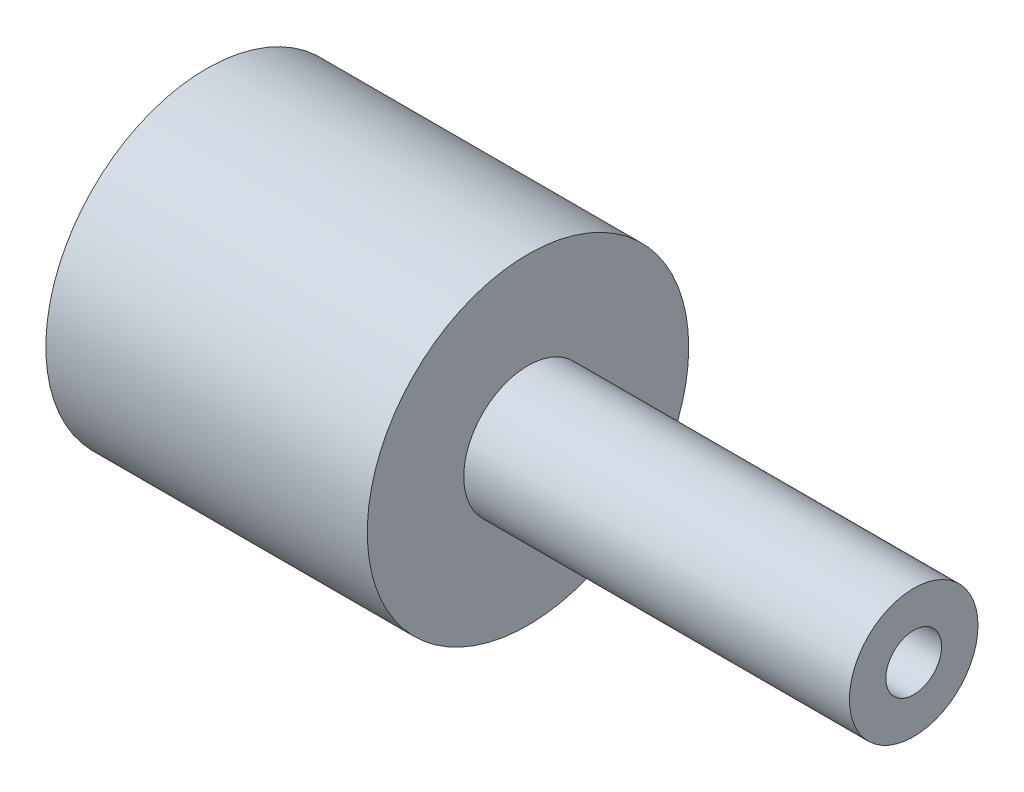
from build123d import *

# Parameters (mm, degrees)
SKETCH_1_R          = 3
EXTRUDE_1_DEPTH     = 33
SKETCH_2_R          = 1.3
CUT_EXTRUDE_1_DEPTH = 5
CUT_EXTRUDE_START   = -5
SKETCH_3_R          = 1.3
CUT_EXTRUDE_2_DEPTH = 5
SKETCH_4_R          = 7.5
SKETCH_4_R_2        = 3
EXTRUDE_2_DEPTH     = 15


with BuildPart() as part:
    # ｽｹｯﾁ1 → ﾎﾞｽ - 押し出し1 (new body)
    with BuildSketch(Plane(origin=(0, 0, 0), x_dir=(0, 0, -1), z_dir=(1, 0, 0))):
        Circle(SKETCH_1_R)
    extrude(amount=EXTRUDE_1_DEPTH)

    # ｽｹｯﾁ2 → ｶｯﾄ - 押し出し1 (cut)
    with BuildSketch(Plane(origin=(33, 0, 0), x_dir=(0, 0, -1), z_dir=(1, 0, 0))):
        Circle(SKETCH_2_R)
    extrude(amount=-CUT_EXTRUDE_1_DEPTH, mode=Mode.SUBTRACT)

    # ｽｹｯﾁ3 → ｶｯﾄ - 押し出し2 (cut)
    with BuildSketch(Plane.ZY.offset(CUT_EXTRUDE_START)):
        with Locations(Location((0, 0, 0), (0, 0, 180))):
            Circle(SKETCH_3_R)
    extrude(amount=CUT_EXTRUDE_2_DEPTH, mode=Mode.SUBTRACT)

    # ｽｹｯﾁ4 → ﾎﾞｽ - 押し出し2 (add)
    with BuildSketch(Plane(origin=(0, 0, 0), x_dir=(0, 0, -1), z_dir=(1, 0, 0))):
        Circle(SKETCH_4_R)
        Circle(SKETCH_4_R_2, mode=Mode.SUBTRACT)
    extrude(amount=EXTRUDE_2_DEPTH)


solid = part.part
